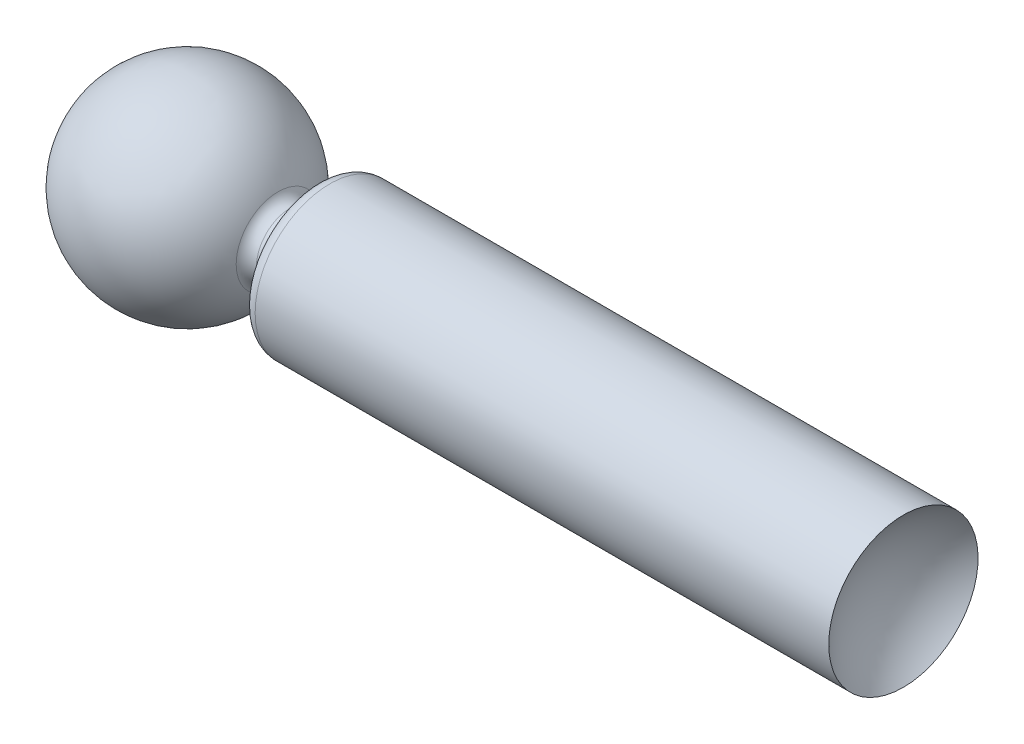
from build123d import *


with BuildPart() as part:
    # Sketch1 → Revolve1 (revolve)
    with BuildSketch(Plane.XY, mode=Mode.PRIVATE) as revolve1_sk:
        with BuildLine():
            Line((9.641935015, 3.175), (10.795, 3.175))
            ThreePointArc((10.795, 3.175), (11.693025612, 3.546974388), (12.065, 4.445))
            Line((12.065, 4.445), (12.065, 5.715))
            ThreePointArc((12.065, 5.715), (12.436974388, 6.613025612), (13.335, 6.985))
            Line((13.335, 6.985), (67.006445218, 6.985))
            ThreePointArc((67.006445218, 6.985), (64.752732969, 3.810778182), (63.9572, 0))
            Line((63.9572, 0), (-9.3472, 0))
            ThreePointArc((-9.3472, 0), (-2.003193278, 9.13002544), (8.488593506, 3.913301435))
            ThreePointArc((8.488593506, 3.913301435), (8.957229669, 3.375383906), (9.641935015, 3.175))
        make_face()
    revolve(revolve1_sk.sketch.rotate(Axis((-323.172189465, 0, 0), (1, 0, 0)), 90), axis=Axis((-323.172189465, 0, 0), (1, 0, 0)))


solid = part.part
